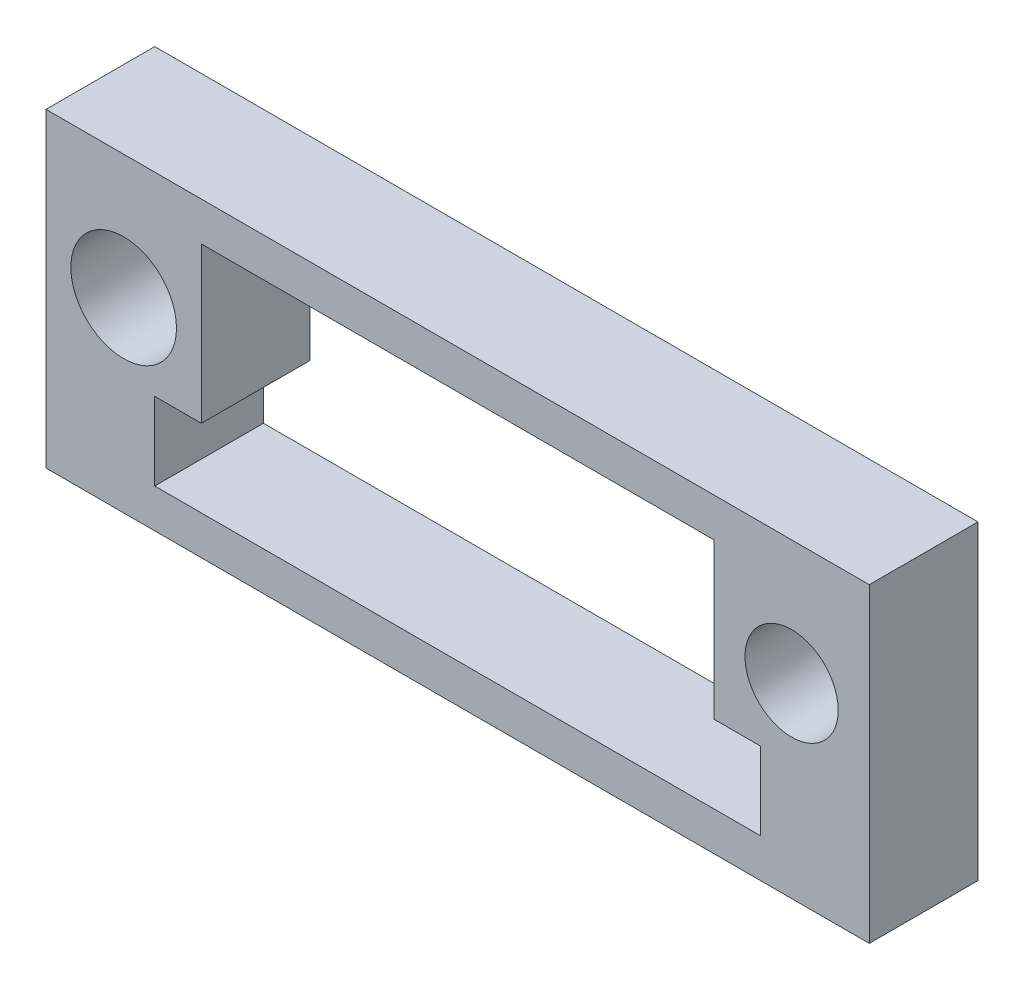
from build123d import *

# Parameters (mm, degrees)
SKETCH1_W           = 53
SKETCH1_H           = 20
SKETCH1_R           = 3.4
SKETCH1_R_2         = 3
BOSS_EXTRUDE2_DEPTH = 7


with BuildPart() as part:
    # Sketch1 → Boss-Extrude2 (new body)
    with BuildSketch(Plane.XY):
        with Locations((-46.622487041, -17.128716042)):
            Rectangle(SKETCH1_W, SKETCH1_H)
        with Locations((-68.122487041, -15.128716042)):
            Circle(SKETCH1_R, mode=Mode.SUBTRACT)
        Polygon((-63.122487041, -19.628716042), (-63.122487041, -9.628716042), (-30.122487041, -9.628716042), (-30.122487041, -19.628716042), (-27.122487041, -19.628716042), (-27.122487041, -24.628716042), (-30.122487041, -24.628716042), (-63.122487041, -24.628716042), (-66.122487041, -24.628716042), (-66.122487041, -19.628716042), align=None, mode=Mode.SUBTRACT)
        with Locations((-25.122487041, -15.128716042)):
            Circle(SKETCH1_R_2, mode=Mode.SUBTRACT)
    extrude(amount=BOSS_EXTRUDE2_DEPTH)


solid = part.part
